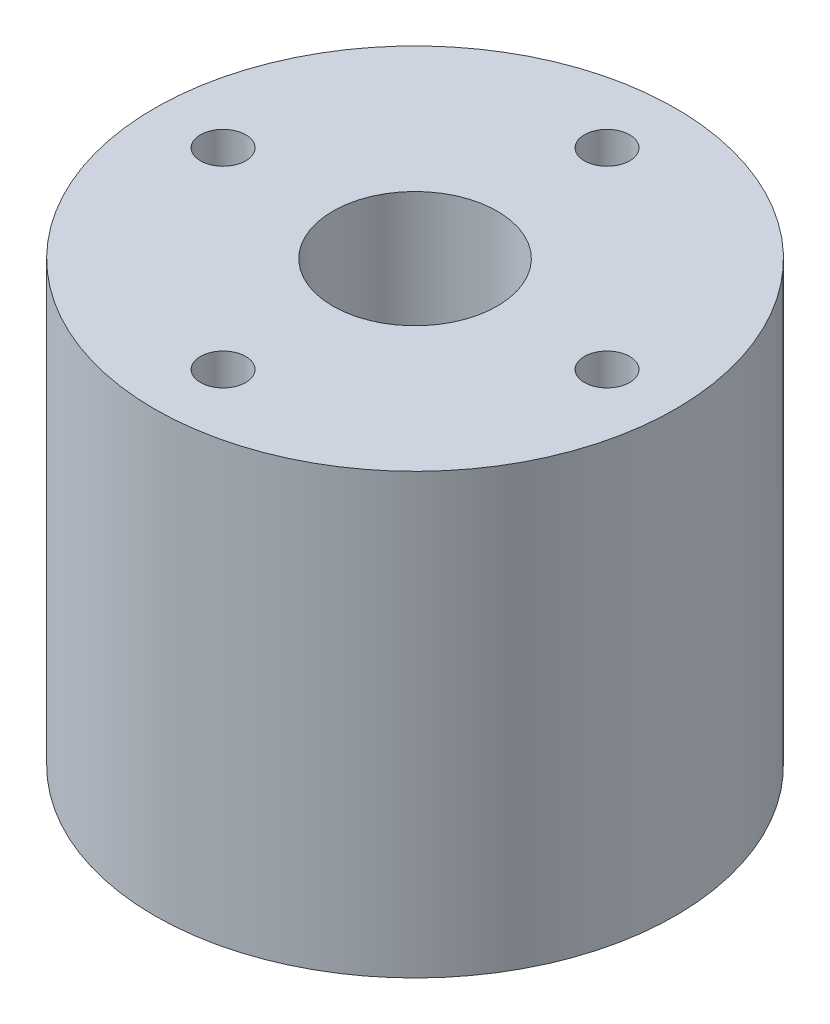
from build123d import *

# Parameters (mm, degrees)
SKETCH_1_R             = 19
SKETCH_1_R_2           = 6
EXTRUDE_1_DEPTH        = 32
SKETCH_2_R             = 2.5
CUT_EXTRUDE_1_DEPTH    = 42.785164832
HOLE_WIZARD_M4_1_D     = 3.3
HOLE_WIZARD_M4_1_DEPTH = 10.1
HOLE_WIZARD_M4_1_TIP   = 0.991420021
HOLE_WIZARD_M4_2_D     = 3.3
HOLE_WIZARD_M4_2_DEPTH = 10.1
HOLE_WIZARD_M4_2_TIP   = 0.991420021


with BuildPart() as part:
    # 草图1 → 凸台-拉伸1 (new body)
    with BuildSketch(Plane(origin=(0, 0, 0), x_dir=(1, 0, 0), z_dir=(0, 1, 0))):
        with Locations(Location((0, 0, 0), (0, 0, 270))):
            Circle(SKETCH_1_R)
        with Locations(Location((0, 0, 0), (0, 0, 270))):
            Circle(SKETCH_1_R_2, mode=Mode.SUBTRACT)
    extrude(amount=EXTRUDE_1_DEPTH)

    # 草图2 → 切除-拉伸1 (cut, through all)
    with BuildSketch(Plane(origin=(0, 0, 0), x_dir=(0, 0, -1), z_dir=(1, 0, 0))):
        with Locations((0, 16)):
            Circle(SKETCH_2_R)
    extrude(amount=-CUT_EXTRUDE_1_DEPTH, mode=Mode.SUBTRACT)

    # M4 螺纹孔1
    with Locations(Plane(origin=(0, 32, 0), x_dir=(-1, 0, 0), z_dir=(0, 1, 0))):
        with Locations((14, 0), (0, 14), (-14, 0), (0, -14)):
            Hole(HOLE_WIZARD_M4_1_D / 2, depth=HOLE_WIZARD_M4_1_DEPTH)
            with Locations((0, 0, -(HOLE_WIZARD_M4_1_DEPTH + HOLE_WIZARD_M4_1_TIP / 2))):  # 118° drill point
                Cone(0, HOLE_WIZARD_M4_1_D / 2, HOLE_WIZARD_M4_1_TIP, mode=Mode.SUBTRACT)

    # M4 螺纹孔2
    with Locations(Plane.XZ):
        with Locations((0, 14), (-14, 0), (0, -14), (14, 0)):
            Hole(HOLE_WIZARD_M4_2_D / 2, depth=HOLE_WIZARD_M4_2_DEPTH)
            with Locations((0, 0, -(HOLE_WIZARD_M4_2_DEPTH + HOLE_WIZARD_M4_2_TIP / 2))):  # 118° drill point
                Cone(0, HOLE_WIZARD_M4_2_D / 2, HOLE_WIZARD_M4_2_TIP, mode=Mode.SUBTRACT)


solid = part.part
